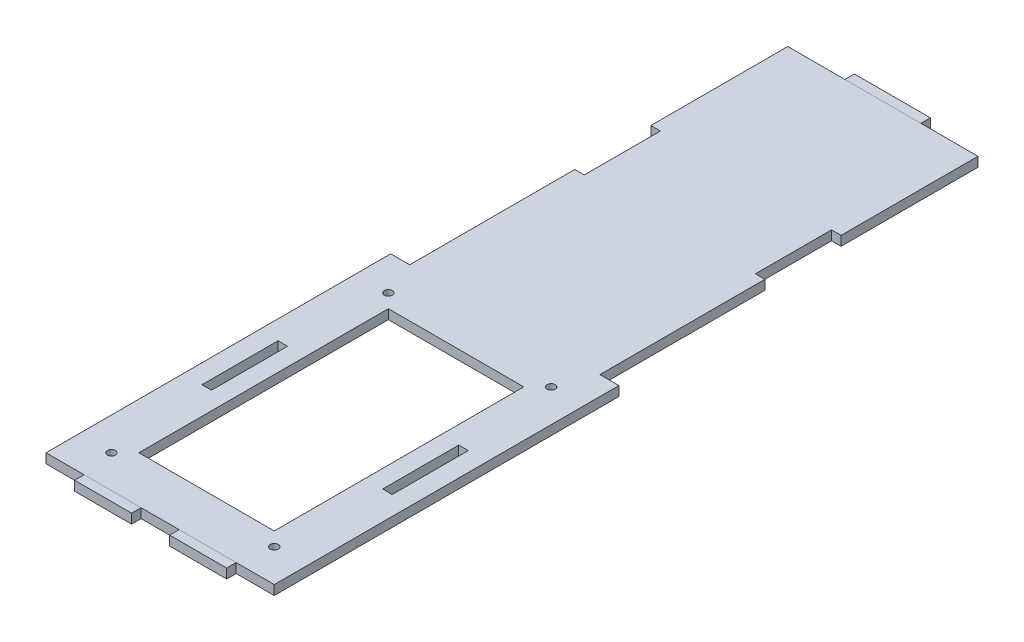
from build123d import *

# Parameters (mm, degrees)
SKETCH1_W             = 76.2
SKETCH1_H             = 241.3
BOSS_EXTRUDE1_DEPTH   = 3.175
SKETCH1_3_W           = 45.212
SKETCH1_3_H           = 83.312
CUT_EXTRUDE2_DEPTH    = 3.175
SKETCH1_5_R           = 1.3499973
CUT_EXTRUDE5_DEPTH    = 3.175
SKETCH1_6_R           = 1.3499973
CUT_EXTRUDE6_DEPTH    = 3.175
SKETCH1_7_R           = 1.3499973
CUT_EXTRUDE7_DEPTH    = 3.175
SKETCH1_8_R           = 1.3499973
CUT_EXTRUDE9_DEPTH    = 3.175
SKETCH5_W             = 6.35
SKETCH5_H             = 126.238
CUT_EXTRUDE11_DEPTH   = 3.175
SKETCH5_4_W           = 6.35
SKETCH5_4_H           = 126.238
CUT_EXTRUDE12_DEPTH   = 3.175
SKETCH7_W             = 3.175
SKETCH7_H             = 25.4
CUT_EXTRUDE13_DEPTH   = 3.175
SKETCH7_3_W           = 3.175
SKETCH7_3_H           = 25.4
CUT_EXTRUDE14_DEPTH   = 3.175
SKETCH8_W             = 19.05
SKETCH8_H             = 3.175
BOSS_EXTRUDE2_DEPTH   = 3.175
BOSS_EXTRUDE2_2_DEPTH = 3.175
SKETCH8_W_2           = 25.4
BOSS_EXTRUDE2_3_DEPTH = 3.175


with BuildPart() as part:
    # Sketch1 → Boss-Extrude1 (new body)
    with BuildSketch(Plane(origin=(0, 0, 0), x_dir=(1, 0, 0), z_dir=(0, 1, 0))):
        Rectangle(SKETCH1_W, SKETCH1_H)
    extrude(amount=BOSS_EXTRUDE1_DEPTH)

    # Sketch1<3> → Cut-Extrude2 (cut)
    with BuildSketch(Plane(origin=(0, 0, 0), x_dir=(1, 0, 0), z_dir=(0, 1, 0))):
        with Locations((0, -63.5)):
            Rectangle(SKETCH1_3_W, SKETCH1_3_H)
    extrude(amount=CUT_EXTRUDE2_DEPTH, mode=Mode.SUBTRACT)

    # Sketch1<5> → Cut-Extrude5 (cut)
    with BuildSketch(Plane(origin=(0, 0, 0), x_dir=(1, 0, 0), z_dir=(0, 1, 0))):
        with Locations((-27.178, -17.272)):
            Circle(SKETCH1_5_R)
    extrude(amount=CUT_EXTRUDE5_DEPTH, mode=Mode.SUBTRACT)

    # Sketch1<6> → Cut-Extrude6 (cut)
    with BuildSketch(Plane(origin=(0, 0, 0), x_dir=(1, 0, 0), z_dir=(0, 1, 0))):
        with Locations((27.178, -17.272)):
            Circle(SKETCH1_6_R)
    extrude(amount=CUT_EXTRUDE6_DEPTH, mode=Mode.SUBTRACT)

    # Sketch1<7> → Cut-Extrude7 (cut)
    with BuildSketch(Plane(origin=(0, 0, 0), x_dir=(1, 0, 0), z_dir=(0, 1, 0))):
        with Locations((-27.178, -109.728)):
            Circle(SKETCH1_7_R)
    extrude(amount=CUT_EXTRUDE7_DEPTH, mode=Mode.SUBTRACT)

    # Sketch1<8> → Cut-Extrude9 (cut)
    with BuildSketch(Plane(origin=(0, 0, 0), x_dir=(1, 0, 0), z_dir=(0, 1, 0))):
        with Locations((27.178, -109.728)):
            Circle(SKETCH1_8_R)
    extrude(amount=CUT_EXTRUDE9_DEPTH, mode=Mode.SUBTRACT)

    # Sketch5 → Cut-Extrude11 (cut)
    with BuildSketch(Plane(origin=(0, 3.175, 0), x_dir=(1, 0, 0), z_dir=(0, 1, 0))):
        with Locations((-34.925, 57.531)):
            Rectangle(SKETCH5_W, SKETCH5_H)
    extrude(amount=-CUT_EXTRUDE11_DEPTH, mode=Mode.SUBTRACT)

    # Sketch5<4> → Cut-Extrude12 (cut)
    with BuildSketch(Plane(origin=(0, 3.175, 0), x_dir=(1, 0, 0), z_dir=(0, 1, 0))):
        with Locations((34.925, 57.531)):
            Rectangle(SKETCH5_4_W, SKETCH5_4_H)
    extrude(amount=-CUT_EXTRUDE12_DEPTH, mode=Mode.SUBTRACT)

    # Sketch7 → Cut-Extrude13 (cut)
    with BuildSketch(Plane(origin=(0, 3.175, 0), x_dir=(1, 0, 0), z_dir=(0, 1, 0))):
        with Locations((-30.1625, -62.23)):
            Rectangle(SKETCH7_W, SKETCH7_H)
    extrude(amount=-CUT_EXTRUDE13_DEPTH, mode=Mode.SUBTRACT)

    # Sketch7<3> → Cut-Extrude14 (cut)
    with BuildSketch(Plane(origin=(0, 3.175, 0), x_dir=(1, 0, 0), z_dir=(0, 1, 0))):
        with Locations((-30.1625, -62.23)):
            Rectangle(SKETCH7_3_W, SKETCH7_3_H)
        with Locations((30.1625, -62.23)):
            Rectangle(SKETCH7_3_W, SKETCH7_3_H)
        with Locations((-30.1625, 62.23)):
            Rectangle(SKETCH7_3_W, SKETCH7_3_H)
        with Locations((30.1625, 62.23)):
            Rectangle(SKETCH7_3_W, SKETCH7_3_H)
    extrude(amount=-CUT_EXTRUDE14_DEPTH, mode=Mode.SUBTRACT)


with BuildPart() as body_2:
    # Sketch8 → Boss-Extrude2 (new body)
    with BuildSketch(Plane(origin=(0, 3.175, 0), x_dir=(1, 0, 0), z_dir=(0, 1, 0))):
        with Locations((-15.875, -122.2375)):
            Rectangle(SKETCH8_W, SKETCH8_H)
    extrude(amount=-BOSS_EXTRUDE2_DEPTH)


with BuildPart() as body_3:
    # Sketch8 → Boss-Extrude2 2 (new body)
    with BuildSketch(Plane(origin=(0, 3.175, 0), x_dir=(1, 0, 0), z_dir=(0, 1, 0))):
        with Locations((15.875, -122.2375)):
            Rectangle(SKETCH8_W, SKETCH8_H)
    extrude(amount=-BOSS_EXTRUDE2_2_DEPTH)


with BuildPart() as body_4:
    # Sketch8 → Boss-Extrude2 3 (new body)
    with BuildSketch(Plane(origin=(0, 3.175, 0), x_dir=(1, 0, 0), z_dir=(0, 1, 0))):
        with Locations((0, 122.2375)):
            Rectangle(SKETCH8_W_2, SKETCH8_H)
    extrude(amount=-BOSS_EXTRUDE2_3_DEPTH)


solid = Compound([part.part, body_2.part, body_3.part, body_4.part])
